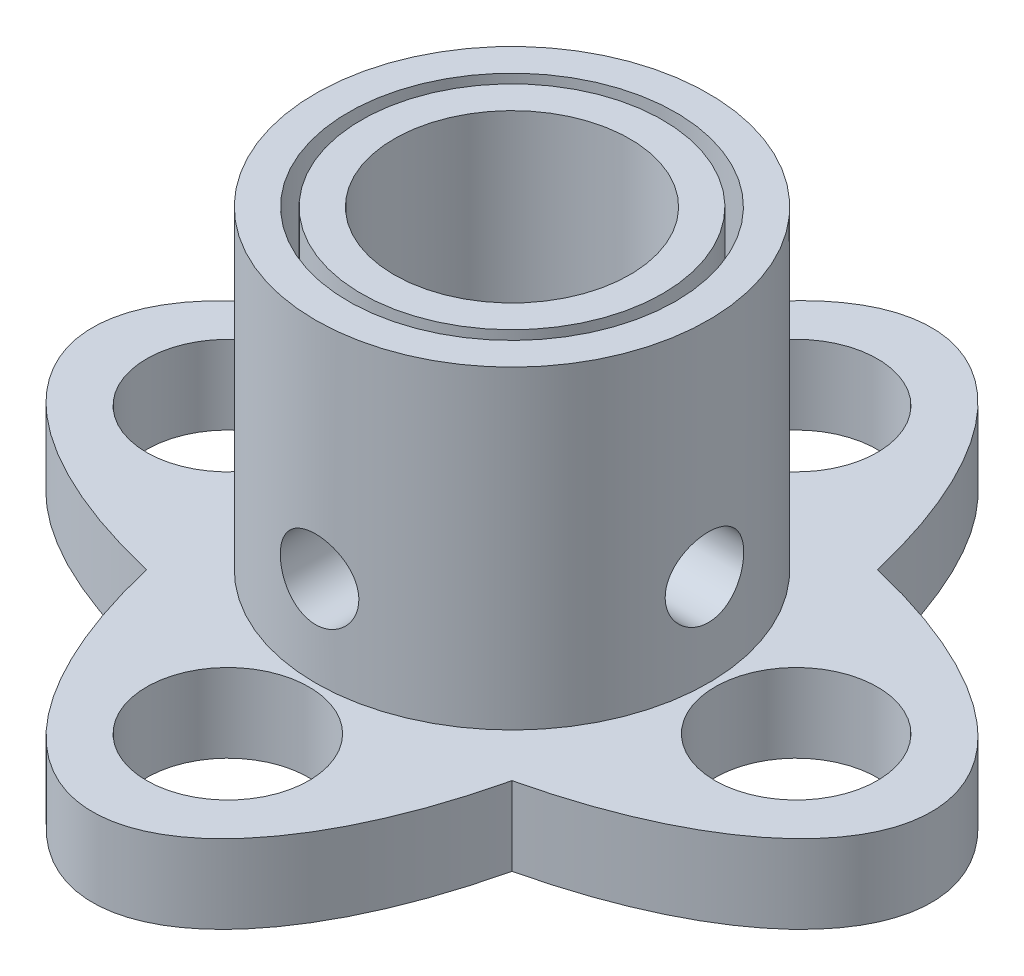
from build123d import *

# Parameters (mm, degrees)
SKETCH1_R               = 3.1
SKETCH1_R_2             = 7.5
BOSS_EXTRUDE1_DEPTH     = 3
SKETCH1_3_R             = 7.5
SKETCH1_3_R_2           = 4.5
BOSS_EXTRUDE2_DEPTH     = 10
CUT_EXTRUDE1_DEPTH      = 25.762107606
CUT_EXTRUDE1_DEPTH_BACK = 25.762107606
SKETCH2_R               = 1.5
CUT_EXTRUDE2_DEPTH      = 25.762107646
CUT_EXTRUDE2_DEPTH_BACK = 25.762107646
SKETCH3_R               = 1.5
SKETCH29_R              = 7.5
SKETCH29_R_2            = 4.5
BOSS_EXTRUDE3_DEPTH     = 5
SKETCH30_R              = 6.25
SKETCH30_R_2            = 5.75
CUT_EXTRUDE_THIN1_DEPTH = 5


with BuildPart() as part:
    # Sketch1 → Boss-Extrude1 (new body)
    with BuildSketch(Plane(origin=(0, 0, 0), x_dir=(1, 0, 0), z_dir=(0, 1, 0))):
        with BuildLine():
            add(Edge.make_bspline(
                [(6.976356378, 6.976356378), (0, 36.778651981), (-6.976356378, 6.976356378)],
                knots=[2.021421456, 2.021421456, 2.021421456, 4.261763851, 4.261763851, 4.261763851], degree=2, weights=[1, 0.435528345, 1]))
            add(Edge.make_bspline(
                [(-6.976356378, 6.976356378), (-36.778651981, 0), (-6.976356378, -6.976356378)],
                knots=[5.16301411, 5.16301411, 5.16301411, 7.403356504, 7.403356504, 7.403356504], degree=2, weights=[1, 0.435528345, 1]))
            add(Edge.make_bspline(
                [(-6.976356378, -6.976356378), (0, -36.778651981), (6.976356378, -6.976356378)],
                knots=[5.16301411, 5.16301411, 5.16301411, 7.403356504, 7.403356504, 7.403356504], degree=2, weights=[1, 0.435528345, 1]))
            add(Edge.make_bspline(
                [(6.976356378, -6.976356378), (36.778651981, 0), (6.976356378, 6.976356378)],
                knots=[2.021421456, 2.021421456, 2.021421456, 4.261763851, 4.261763851, 4.261763851], degree=2, weights=[1, 0.435528345, 1]))
        make_face()
        with Locations((0, -10.851478773)):
            Circle(SKETCH1_R, mode=Mode.SUBTRACT)
        with Locations((-10.851478773, 0)):
            Circle(SKETCH1_R, mode=Mode.SUBTRACT)
        Circle(SKETCH1_R_2, mode=Mode.SUBTRACT)
        with Locations((10.851478773, 0)):
            Circle(SKETCH1_R, mode=Mode.SUBTRACT)
        with Locations((0, 10.851478773)):
            Circle(SKETCH1_R, mode=Mode.SUBTRACT)
    extrude(amount=BOSS_EXTRUDE1_DEPTH)

    # Sketch1<3> → Boss-Extrude2 (add)
    with BuildSketch(Plane(origin=(0, 0, 0), x_dir=(1, 0, 0), z_dir=(0, 1, 0))):
        Circle(SKETCH1_3_R)
        Circle(SKETCH1_3_R_2, mode=Mode.SUBTRACT)
    extrude(amount=BOSS_EXTRUDE2_DEPTH)

    # Sketch2 → Cut-Extrude1 (cut, two sides: drawn at the far end of the back side and taken through both)
    with BuildSketch(Plane.XY.offset(-CUT_EXTRUDE1_DEPTH_BACK)):
        with Locations((0, 6.432645923)):
            Circle(SKETCH2_R)
    extrude(amount=CUT_EXTRUDE1_DEPTH + CUT_EXTRUDE1_DEPTH_BACK, mode=Mode.SUBTRACT)

    # Sketch3 → Cut-Extrude2 (cut, two sides: drawn at the far end of the back side and taken through both)
    with BuildSketch(Plane(origin=(0, 0, 0), x_dir=(0, 0, -1), z_dir=(1, 0, 0)).offset(-CUT_EXTRUDE2_DEPTH_BACK)):
        with Locations((0, 6.5)):
            Circle(SKETCH3_R)
    extrude(amount=CUT_EXTRUDE2_DEPTH + CUT_EXTRUDE2_DEPTH_BACK, mode=Mode.SUBTRACT)

    # Sketch29 → Boss-Extrude3 (add)
    with BuildSketch(Plane(origin=(0, 10, 0), x_dir=(1, 0, 0), z_dir=(0, 1, 0))):
        Circle(SKETCH29_R)
        Circle(SKETCH29_R_2, mode=Mode.SUBTRACT)
    extrude(amount=BOSS_EXTRUDE3_DEPTH)

    # Sketch30 → Cut-Extrude-Thin1 (cut)
    with BuildSketch(Plane(origin=(0, 15, 0), x_dir=(1, 0, 0), z_dir=(0, 1, 0))):
        Circle(SKETCH30_R)
        Circle(SKETCH30_R_2, mode=Mode.SUBTRACT)
    extrude(amount=-CUT_EXTRUDE_THIN1_DEPTH, mode=Mode.SUBTRACT)


solid = part.part
